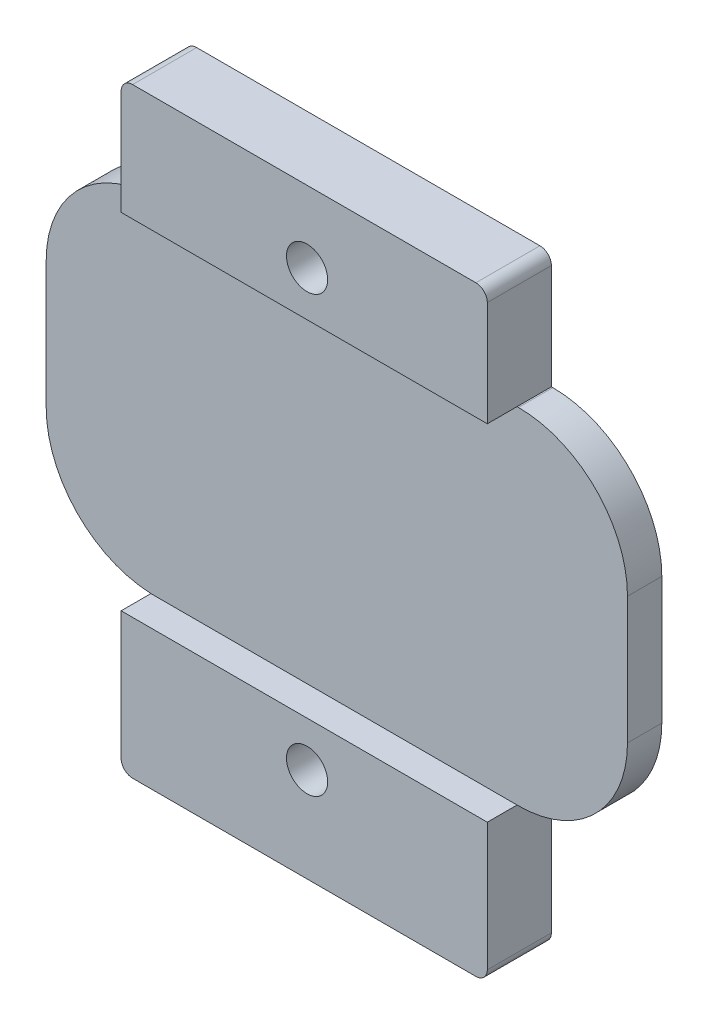
from build123d import *

# Parameters (mm, degrees)
BOSS_EXTRUDE1_DEPTH = 3
BOSS_EXTRUDE2_DEPTH = 2.6
BOSS_EXTRUDE3_DEPTH = 3
SKETCH8_R           = 1.8
CUT_EXTRUDE2_DEPTH  = 8


with BuildPart() as part:
    # Sketch1 → Boss-Extrude1 (new body)
    with BuildSketch(Plane.XY):
        with BuildLine():
            Line((-15.250000001, 13.250000001), (14.75, 13.250000001))
            ThreePointArc((14.75, 13.250000001), (15.457106781, 12.957106782), (15.75, 12.250000001))
            Line((15.75, 12.250000001), (15.75, -38.249999999))
            ThreePointArc((15.75, -38.249999999), (15.457106781, -38.95710678), (14.75, -39.249999999))
            Line((14.75, -39.249999999), (-15.250000001, -39.249999999))
            ThreePointArc((-15.250000001, -39.249999999), (-15.957106782, -38.95710678), (-16.250000001, -38.249999999))
            Line((-16.250000001, -38.249999999), (-16.250000001, 12.250000001))
            ThreePointArc((-16.250000001, 12.250000001), (-15.957106782, 12.957106782), (-15.250000001, 13.250000001))
        make_face()
    extrude(amount=BOSS_EXTRUDE1_DEPTH)

    # Sketch2 → Boss-Extrude2 (add)
    with BuildSketch(Plane.XY.offset(3)):
        with BuildLine():
            Line((15.75, -38.249999999), (15.75, -27.074999999))
            Line((15.75, -27.074999999), (-16.250000001, -27.074999999))
            Line((-16.250000001, -27.074999999), (-16.250000001, -38.249999999))
            ThreePointArc((-16.250000001, -38.249999999), (-15.957106782, -38.95710678), (-15.250000001, -39.249999999))
            Line((-15.250000001, -39.249999999), (14.75, -39.249999999))
            ThreePointArc((14.75, -39.249999999), (15.457106781, -38.95710678), (15.75, -38.249999999))
        make_face()
        with BuildLine():
            Line((14.75, 13.250000001), (-15.250000001, 13.250000001))
            ThreePointArc((-15.250000001, 13.250000001), (-15.957106782, 12.957106782), (-16.250000001, 12.250000001))
            Line((-16.250000001, 12.250000001), (-16.250000001, 3.075000001))
            Line((-16.250000001, 3.075000001), (15.75, 3.075000001))
            Line((15.75, 3.075000001), (15.75, 12.250000001))
            ThreePointArc((15.75, 12.250000001), (15.457106781, 12.957106782), (14.75, 13.250000001))
        make_face()
    extrude(amount=BOSS_EXTRUDE2_DEPTH)

    # Sketch7 → Boss-Extrude3 (add)
    with BuildSketch(Plane.XY.offset(3)):
        with BuildLine():
            Line((-14.732, 3.074800001), (14.732, 3.074800001))
            Line((14.732, 3.074800001), (15.875, 3.074800001))
            ThreePointArc((15.875, 3.074800001), (22.610192091, 0.284992092), (25.4, -6.450199999))
            Line((25.4, -6.450199999), (25.4, -17.549999999))
            ThreePointArc((25.4, -17.549999999), (22.610192091, -24.28519209), (15.875, -27.074999999))
            Line((15.875, -27.074999999), (14.732, -27.074999999))
            Line((14.732, -27.074999999), (-14.732, -27.074999999))
            Line((-14.732, -27.074999999), (-15.875, -27.074999999))
            ThreePointArc((-15.875, -27.074999999), (-22.610192091, -24.28519209), (-25.4, -17.549999999))
            Line((-25.4, -17.549999999), (-25.4, -6.450199999))
            ThreePointArc((-25.4, -6.450199999), (-22.610192091, 0.284992092), (-15.875, 3.074800001))
            Line((-15.875, 3.074800001), (-14.732, 3.074800001))
        make_face()
    extrude(amount=-BOSS_EXTRUDE3_DEPTH)

    # Sketch8 → Cut-Extrude2 (cut)
    with BuildSketch(Plane.XY):
        with Locations((0, 7)):
            Circle(SKETCH8_R)
        with Locations((0, -31)):
            Circle(SKETCH8_R)
    extrude(amount=CUT_EXTRUDE2_DEPTH, mode=Mode.SUBTRACT)


solid = part.part
